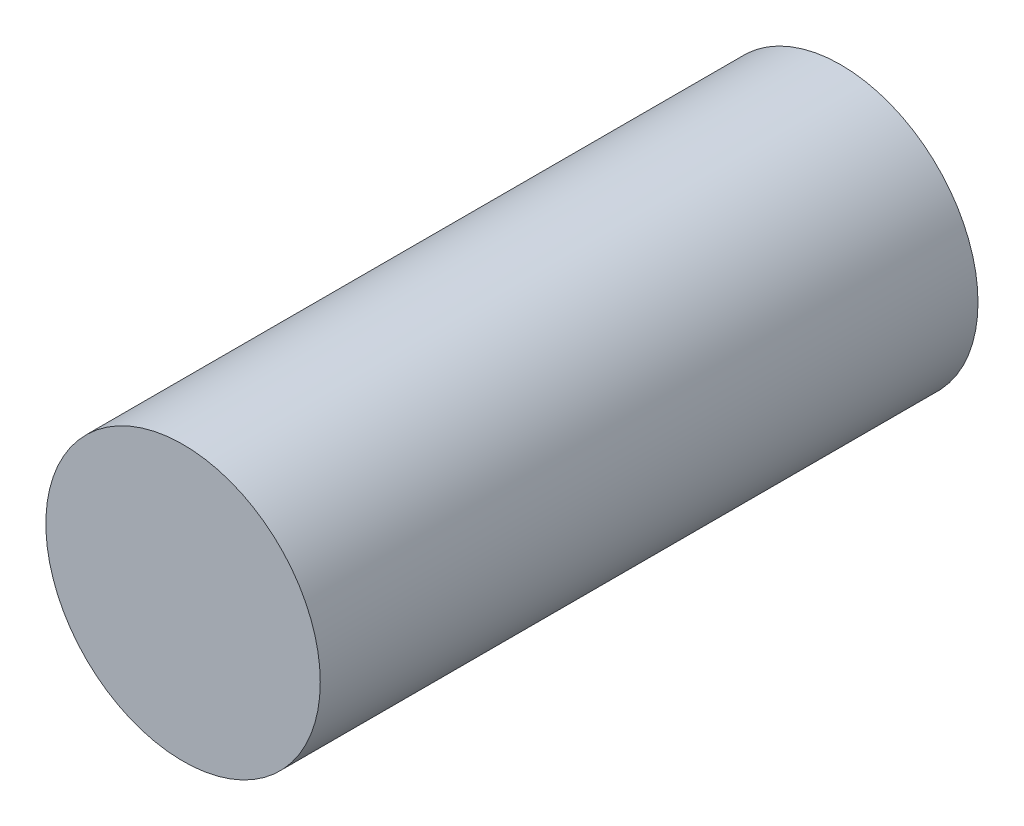
from build123d import *

# Parameters (mm, degrees)
SKETCH_1_R      = 4
EXTRUDE_1_DEPTH = 19.174007306


with BuildPart() as part:
    # 草图1 → 凸台-拉伸1 (new body)
    with BuildSketch(Plane.XY):
        with Locations((57.073644085, 292.857154946)):
            Circle(SKETCH_1_R)
    extrude(amount=-EXTRUDE_1_DEPTH)


solid = part.part
